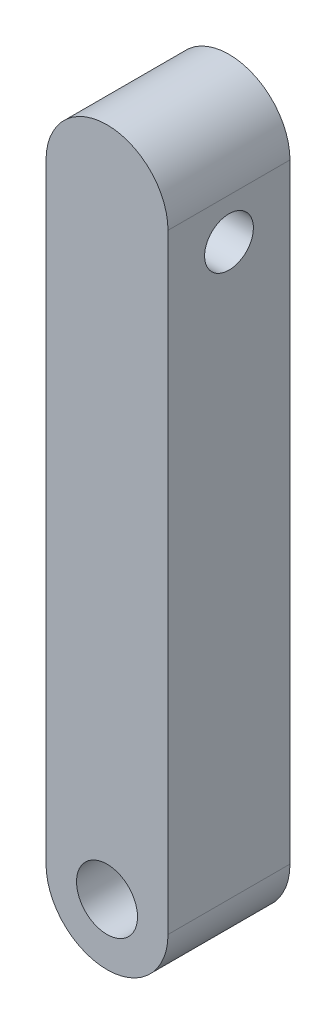
from build123d import *

# Parameters (mm, degrees)
SKETCH2_R           = 5
BOSS_EXTRUDE1_DEPTH = 20
SKETCH4_R           = 4
CUT_EXTRUDE1_DEPTH  = 26


with BuildPart() as part:
    # Sketch2 → Boss-Extrude1 (new body)
    with BuildSketch(Plane.XY):
        with BuildLine():
            Line((-10, -50), (-10, 50))
            ThreePointArc((-10, 50), (0, 60), (10, 50))
            Line((10, 50), (10, -50))
            ThreePointArc((10, -50), (0, -60), (-10, -50))
        make_face()
        with Locations((0, -50)):
            Circle(SKETCH2_R, mode=Mode.SUBTRACT)
    extrude(amount=BOSS_EXTRUDE1_DEPTH)

    # Sketch4 → Cut-Extrude1 (cut)
    with BuildSketch(Plane(origin=(10, 0, 0), x_dir=(0, 0, -1), z_dir=(1, 0, 0))):
        with Locations(Location((-10, 43.355409554, 0), (0, 0, 90))):
            Circle(SKETCH4_R)
    extrude(amount=-CUT_EXTRUDE1_DEPTH, mode=Mode.SUBTRACT)


solid = part.part
